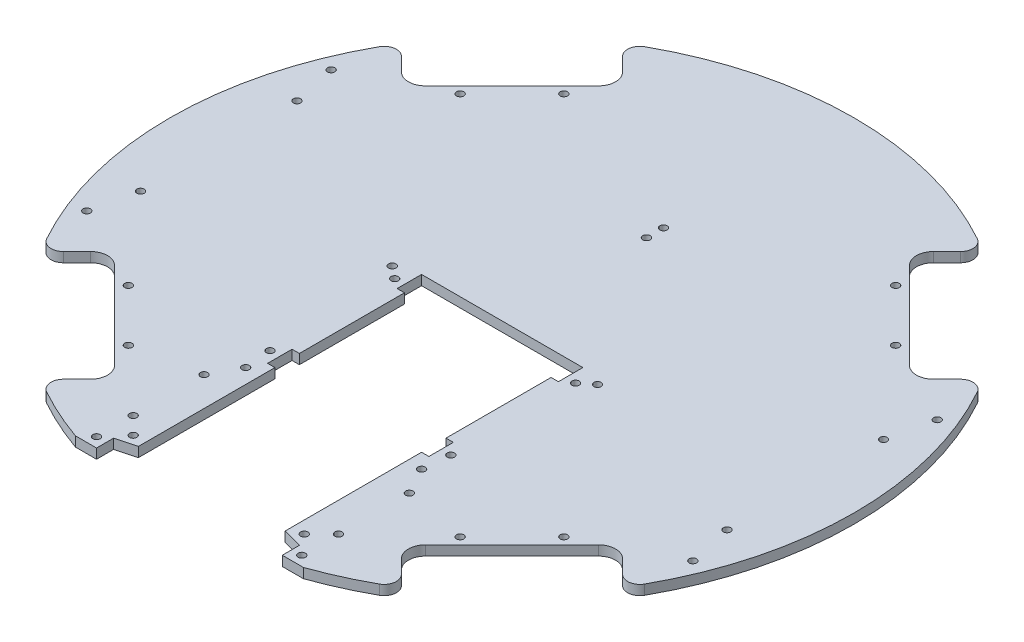
from build123d import *

# Parameters (mm, degrees)
SKETCH1_R                = 140
BOSS_EXTRUDE1_DEPTH      = 4
CUT_EXTRUDE4_REACH       = 200.03
CUT_EXTRUDE6_REACH       = 200.03
SKETCH9_R                = 1.5
FILLET1_R                = 5
CIRPATTERN1_COUNT        = 4
FILLET1_OF_CIRPATTERN1_R = 5
CUT_EXTRUDE1_REACH       = 200.03
FILLET3_R                = 1.5
CUT_EXTRUDE7_REACH       = 200.03
SKETCH10_R               = 1.5
CUT_EXTRUDE9_REACH       = 200.03
SKETCH13_R               = 1.5
CUT_EXTRUDE12_REACH      = 200.03
SKETCH16_R               = 1.5
CUT_EXTRUDE13_REACH      = 200.03
SKETCH17_R               = 1.5
CUT_EXTRUDE15_REACH      = 200.03
SKETCH19_R               = 1.5
CUT_EXTRUDE17_REACH      = 200.03
SKETCH21_R               = 1.5
CUT_EXTRUDE18_REACH      = 200.03
SKETCH22_R               = 1.5


with BuildPart() as part:
    # Sketch1 → Boss-Extrude1 (new body)
    with BuildSketch(Plane(origin=(0, 0, 0), x_dir=(1, 0, 0), z_dir=(0, 1, 0))):
        with Locations(Location((0, 0, 0), (0, 0, 270))):
            Circle(SKETCH1_R)
    extrude(amount=BOSS_EXTRUDE1_DEPTH)

    # Sketch7 → Cut-Extrude4 (cut, up to next)
    with BuildSketch(Plane(origin=(0, 4, 0), x_dir=(1, 0, 0), z_dir=(0, 1, 0)), mode=Mode.PRIVATE) as cut_extrude4_sk1:
        with BuildLine():
            Line((-99.030304705, -63.604254968), (-63.604254968, -99.030304705))
            ThreePointArc((-63.604254968, -99.030304705), (-61.568647097, -103.944696834), (-63.604254968, -108.859088964))
            Line((-63.604254968, -108.859088964), (-76.367532368, -121.622366364))
            Line((-76.367532368, -121.622366364), (-121.622366364, -76.367532368))
            Line((-121.622366364, -76.367532368), (-108.859088964, -63.604254968))
            ThreePointArc((-108.859088964, -63.604254968), (-103.944696834, -61.568647097), (-99.030304705, -63.604254968))
        make_face()
    cut_extrude4_tool1 = extrude(cut_extrude4_sk1.sketch, amount=-CUT_EXTRUDE4_REACH, mode=Mode.PRIVATE) & part.part
    cut_extrude4 = cut_extrude4_tool1.solids().sort_by_distance((-90.257735, 4, 90.257735))[0]
    add(cut_extrude4, mode=Mode.SUBTRACT)

    # Sketch9 → Cut-Extrude6 (cut, up to next)
    with BuildSketch(Plane(origin=(0, 4, 0), x_dir=(1, 0, 0), z_dir=(0, 1, 0)), mode=Mode.PRIVATE) as cut_extrude6_sk1:
        with Locations(Location((-89.09545443, -67.882250994, 0), (0, 0, 270))):
            Circle(SKETCH9_R)
    cut_extrude6_tool1 = extrude(cut_extrude6_sk1.sketch, amount=-CUT_EXTRUDE6_REACH, mode=Mode.PRIVATE) & part.part
    # Sketch9 → Cut-Extrude6 (cut, up to next)
    with BuildSketch(Plane(origin=(0, 4, 0), x_dir=(1, 0, 0), z_dir=(0, 1, 0)), mode=Mode.PRIVATE) as cut_extrude6_sk2:
        with Locations(Location((-67.882250994, -89.09545443, 0), (0, 0, 270))):
            Circle(SKETCH9_R)
    cut_extrude6_tool2 = extrude(cut_extrude6_sk2.sketch, amount=-CUT_EXTRUDE6_REACH, mode=Mode.PRIVATE) & part.part
    cut_extrude6_1 = cut_extrude6_tool1.solids().sort_by_distance((-89.095454, 4, 67.882251))[0]
    add(cut_extrude6_1, mode=Mode.SUBTRACT)
    cut_extrude6_2 = cut_extrude6_tool2.solids().sort_by_distance((-67.882251, 4, 89.095454))[0]
    add(cut_extrude6_2, mode=Mode.SUBTRACT)
    cut_extrude6 = cut_extrude6_1 + cut_extrude6_2  # Cut-Extrude6 as one shape, for the pattern or mirror that repeats it

    # Fillet1
    fillet1_edges = [part.edges().sort_by_distance(p)[0] for p in [
        (-119.001687423, 2, 73.746853427),
        (-73.746853427, 2, 119.001687423),
    ]]
    fillet(fillet1_edges, radius=FILLET1_R)

    # CirPattern1: Cut-Extrude4, Cut-Extrude6 ×4 about axis
    cirpattern1_axis = Axis((0, 0, 0), (0, 1, 0))
    add([cut_extrude4.rotate(cirpattern1_axis, i * 360 / CIRPATTERN1_COUNT) for i in range(1, CIRPATTERN1_COUNT)], mode=Mode.SUBTRACT)
    add([cut_extrude6.rotate(cirpattern1_axis, i * 360 / CIRPATTERN1_COUNT) for i in range(1, CIRPATTERN1_COUNT)], mode=Mode.SUBTRACT)

    # Fillet1 of CirPattern1
    fillet1_of_cirpattern1_edges = [part.edges().sort_by_distance(p)[0] for p in [
        (73.746853427, 2, 119.001687423),
        (119.001687423, 2, 73.746853427),
        (119.001687423, 2, -73.746853427),
        (73.746853427, 2, -119.001687423),
        (-73.746853427, 2, -119.001687423),
        (-119.001687423, 2, -73.746853427),
    ]]
    fillet(fillet1_of_cirpattern1_edges, radius=FILLET1_OF_CIRPATTERN1_R)

    # Sketch2 → Cut-Extrude1 (cut, up to next)
    with BuildSketch(Plane(origin=(0, 4, 0), x_dir=(1, 0, 0), z_dir=(0, 1, 0)), mode=Mode.PRIVATE) as cut_extrude1_sk1:
        Polygon((-46.647615159, -132), (-38, -132), (-38, -125), (-30, -122.856406461), (-30, -67), (-33, -67), (-33, -57), (-30, -57), (-30, -14), (-33, -14), (-33, -4), (33, -4), (33, -14), (30, -14), (30, -57), (33, -57), (33, -67), (30, -67), (30, -122.856406461), (38, -125), (38, -132), (46.647615159, -132), (46.647615159, -140), (-46.647615159, -140), align=None)
    cut_extrude1_tool1 = extrude(cut_extrude1_sk1.sketch, amount=-CUT_EXTRUDE1_REACH, mode=Mode.PRIVATE) & part.part
    add(cut_extrude1_tool1.solids().sort_by_distance((0, 4, 74.292867))[0], mode=Mode.SUBTRACT)

    # Fillet3
    fillet3_edges = [part.edges().sort_by_distance(p)[0] for p in [
        (66.382250994, 0, 89.09545443),
        (87.59545443, 0, 67.882250994),
        (89.09545443, 0, -66.382250994),
        (67.882250994, 0, -87.59545443),
        (-66.382250994, 0, -89.09545443),
        (-87.59545443, 0, -67.882250994),
        (-89.09545443, 0, 66.382250994),
        (-67.882250994, 0, 87.59545443),
    ]]
    fillet(fillet3_edges, radius=FILLET3_R)

    # Sketch10 → Cut-Extrude7 (cut, up to next)
    with BuildSketch(Plane(origin=(0, 4, 0), x_dir=(1, 0, 0), z_dir=(0, 1, 0)), mode=Mode.PRIVATE) as cut_extrude7_sk1:
        with Locations(Location((-37, -62, 0), (0, 0, 270))):
            Circle(SKETCH10_R)
    cut_extrude7_tool1 = extrude(cut_extrude7_sk1.sketch, amount=-CUT_EXTRUDE7_REACH, mode=Mode.PRIVATE) & part.part
    # Sketch10 → Cut-Extrude7 (cut, up to next)
    with BuildSketch(Plane(origin=(0, 4, 0), x_dir=(1, 0, 0), z_dir=(0, 1, 0)), mode=Mode.PRIVATE) as cut_extrude7_sk2:
        with Locations(Location((37, -62, 0), (0, 0, 270))):
            Circle(SKETCH10_R)
    cut_extrude7_tool2 = extrude(cut_extrude7_sk2.sketch, amount=-CUT_EXTRUDE7_REACH, mode=Mode.PRIVATE) & part.part
    # Sketch10 → Cut-Extrude7 (cut, up to next)
    with BuildSketch(Plane(origin=(0, 4, 0), x_dir=(1, 0, 0), z_dir=(0, 1, 0)), mode=Mode.PRIVATE) as cut_extrude7_sk3:
        with Locations(Location((-37, -11, 0), (0, 0, 270))):
            Circle(SKETCH10_R)
    cut_extrude7_tool3 = extrude(cut_extrude7_sk3.sketch, amount=-CUT_EXTRUDE7_REACH, mode=Mode.PRIVATE) & part.part
    # Sketch10 → Cut-Extrude7 (cut, up to next)
    with BuildSketch(Plane(origin=(0, 4, 0), x_dir=(1, 0, 0), z_dir=(0, 1, 0)), mode=Mode.PRIVATE) as cut_extrude7_sk4:
        with Locations(Location((37, -11, 0), (0, 0, 270))):
            Circle(SKETCH10_R)
    cut_extrude7_tool4 = extrude(cut_extrude7_sk4.sketch, amount=-CUT_EXTRUDE7_REACH, mode=Mode.PRIVATE) & part.part
    # Sketch10 → Cut-Extrude7 (cut, up to next)
    with BuildSketch(Plane(origin=(0, 4, 0), x_dir=(1, 0, 0), z_dir=(0, 1, 0)), mode=Mode.PRIVATE) as cut_extrude7_sk5:
        with Locations(Location((-42, -7, 0), (0, 0, 270))):
            Circle(SKETCH10_R)
    cut_extrude7_tool5 = extrude(cut_extrude7_sk5.sketch, amount=-CUT_EXTRUDE7_REACH, mode=Mode.PRIVATE) & part.part
    # Sketch10 → Cut-Extrude7 (cut, up to next)
    with BuildSketch(Plane(origin=(0, 4, 0), x_dir=(1, 0, 0), z_dir=(0, 1, 0)), mode=Mode.PRIVATE) as cut_extrude7_sk6:
        with Locations(Location((42, -7, 0), (0, 0, 270))):
            Circle(SKETCH10_R)
    cut_extrude7_tool6 = extrude(cut_extrude7_sk6.sketch, amount=-CUT_EXTRUDE7_REACH, mode=Mode.PRIVATE) & part.part
    add(cut_extrude7_tool1.solids().sort_by_distance((-37, 4, 62))[0], mode=Mode.SUBTRACT)
    add(cut_extrude7_tool2.solids().sort_by_distance((37, 4, 62))[0], mode=Mode.SUBTRACT)
    add(cut_extrude7_tool3.solids().sort_by_distance((-37, 4, 11))[0], mode=Mode.SUBTRACT)
    add(cut_extrude7_tool4.solids().sort_by_distance((37, 4, 11))[0], mode=Mode.SUBTRACT)
    add(cut_extrude7_tool5.solids().sort_by_distance((-42, 4, 7))[0], mode=Mode.SUBTRACT)
    add(cut_extrude7_tool6.solids().sort_by_distance((42, 4, 7))[0], mode=Mode.SUBTRACT)

    # Sketch13 → Cut-Extrude9 (cut, up to next)
    with BuildSketch(Plane(origin=(0, 4, 0), x_dir=(1, 0, 0), z_dir=(0, 1, 0)), mode=Mode.PRIVATE) as cut_extrude9_sk1:
        with Locations(Location((-42, -84, 0), (0, 0, 270))):
            Circle(SKETCH13_R)
    cut_extrude9_tool1 = extrude(cut_extrude9_sk1.sketch, amount=-CUT_EXTRUDE9_REACH, mode=Mode.PRIVATE) & part.part
    # Sketch13 → Cut-Extrude9 (cut, up to next)
    with BuildSketch(Plane(origin=(0, 4, 0), x_dir=(1, 0, 0), z_dir=(0, 1, 0)), mode=Mode.PRIVATE) as cut_extrude9_sk2:
        with Locations(Location((-42, -113, 0), (0, 0, 270))):
            Circle(SKETCH13_R)
    cut_extrude9_tool2 = extrude(cut_extrude9_sk2.sketch, amount=-CUT_EXTRUDE9_REACH, mode=Mode.PRIVATE) & part.part
    # Sketch13 → Cut-Extrude9 (cut, up to next)
    with BuildSketch(Plane(origin=(0, 4, 0), x_dir=(1, 0, 0), z_dir=(0, 1, 0)), mode=Mode.PRIVATE) as cut_extrude9_sk3:
        with Locations(Location((42, -113, 0), (0, 0, 270))):
            Circle(SKETCH13_R)
    cut_extrude9_tool3 = extrude(cut_extrude9_sk3.sketch, amount=-CUT_EXTRUDE9_REACH, mode=Mode.PRIVATE) & part.part
    # Sketch13 → Cut-Extrude9 (cut, up to next)
    with BuildSketch(Plane(origin=(0, 4, 0), x_dir=(1, 0, 0), z_dir=(0, 1, 0)), mode=Mode.PRIVATE) as cut_extrude9_sk4:
        with Locations(Location((42, -84, 0), (0, 0, 270))):
            Circle(SKETCH13_R)
    cut_extrude9_tool4 = extrude(cut_extrude9_sk4.sketch, amount=-CUT_EXTRUDE9_REACH, mode=Mode.PRIVATE) & part.part
    add(cut_extrude9_tool1.solids().sort_by_distance((-42, 4, 84))[0], mode=Mode.SUBTRACT)
    add(cut_extrude9_tool2.solids().sort_by_distance((-42, 4, 113))[0], mode=Mode.SUBTRACT)
    add(cut_extrude9_tool3.solids().sort_by_distance((42, 4, 113))[0], mode=Mode.SUBTRACT)
    add(cut_extrude9_tool4.solids().sort_by_distance((42, 4, 84))[0], mode=Mode.SUBTRACT)

    # Sketch16 → Cut-Extrude12 (cut, up to next)
    with BuildSketch(Plane(origin=(0, 4, 0), x_dir=(1, 0, 0), z_dir=(0, 1, 0)), mode=Mode.PRIVATE) as cut_extrude12_sk1:
        with Locations(Location((0, 62, 0), (0, 0, 270))):
            Circle(SKETCH16_R)
    cut_extrude12_tool1 = extrude(cut_extrude12_sk1.sketch, amount=-CUT_EXTRUDE12_REACH, mode=Mode.PRIVATE) & part.part
    # Sketch16 → Cut-Extrude12 (cut, up to next)
    with BuildSketch(Plane(origin=(0, 4, 0), x_dir=(1, 0, 0), z_dir=(0, 1, 0)), mode=Mode.PRIVATE) as cut_extrude12_sk2:
        with Locations(Location((0, 55, 0), (0, 0, 270))):
            Circle(SKETCH16_R)
    cut_extrude12_tool2 = extrude(cut_extrude12_sk2.sketch, amount=-CUT_EXTRUDE12_REACH, mode=Mode.PRIVATE) & part.part
    add(cut_extrude12_tool1.solids().sort_by_distance((0, 4, -62))[0], mode=Mode.SUBTRACT)
    add(cut_extrude12_tool2.solids().sort_by_distance((0, 4, -55))[0], mode=Mode.SUBTRACT)

    # Sketch17 → Cut-Extrude13 (cut, up to next)
    with BuildSketch(Plane(origin=(0, 4, 0), x_dir=(1, 0, 0), z_dir=(0, 1, 0)), mode=Mode.PRIVATE) as cut_extrude13_sk1:
        with Locations(Location((-124, 50, 0), (0, 0, 270))):
            Circle(SKETCH17_R)
    cut_extrude13_tool1 = extrude(cut_extrude13_sk1.sketch, amount=-CUT_EXTRUDE13_REACH, mode=Mode.PRIVATE) & part.part
    # Sketch17 → Cut-Extrude13 (cut, up to next)
    with BuildSketch(Plane(origin=(0, 4, 0), x_dir=(1, 0, 0), z_dir=(0, 1, 0)), mode=Mode.PRIVATE) as cut_extrude13_sk2:
        with Locations(Location((-124, -50, 0), (0, 0, 270))):
            Circle(SKETCH17_R)
    cut_extrude13_tool2 = extrude(cut_extrude13_sk2.sketch, amount=-CUT_EXTRUDE13_REACH, mode=Mode.PRIVATE) & part.part
    # Sketch17 → Cut-Extrude13 (cut, up to next)
    with BuildSketch(Plane(origin=(0, 4, 0), x_dir=(1, 0, 0), z_dir=(0, 1, 0)), mode=Mode.PRIVATE) as cut_extrude13_sk3:
        with Locations(Location((124, 50, 0), (0, 0, 270))):
            Circle(SKETCH17_R)
    cut_extrude13_tool3 = extrude(cut_extrude13_sk3.sketch, amount=-CUT_EXTRUDE13_REACH, mode=Mode.PRIVATE) & part.part
    # Sketch17 → Cut-Extrude13 (cut, up to next)
    with BuildSketch(Plane(origin=(0, 4, 0), x_dir=(1, 0, 0), z_dir=(0, 1, 0)), mode=Mode.PRIVATE) as cut_extrude13_sk4:
        with Locations(Location((124, -50, 0), (0, 0, 270))):
            Circle(SKETCH17_R)
    cut_extrude13_tool4 = extrude(cut_extrude13_sk4.sketch, amount=-CUT_EXTRUDE13_REACH, mode=Mode.PRIVATE) & part.part
    add(cut_extrude13_tool1.solids().sort_by_distance((-124, 4, -50))[0], mode=Mode.SUBTRACT)
    add(cut_extrude13_tool2.solids().sort_by_distance((-124, 4, 50))[0], mode=Mode.SUBTRACT)
    add(cut_extrude13_tool3.solids().sort_by_distance((124, 4, -50))[0], mode=Mode.SUBTRACT)
    add(cut_extrude13_tool4.solids().sort_by_distance((124, 4, 50))[0], mode=Mode.SUBTRACT)

    # Sketch19 → Cut-Extrude15 (cut, up to next)
    with BuildSketch(Plane(origin=(0, 4, 0), x_dir=(1, 0, 0), z_dir=(0, 1, 0)), mode=Mode.PRIVATE) as cut_extrude15_sk1:
        with Locations(Location((-42, -128, 0), (0, 0, 270))):
            Circle(SKETCH19_R)
    cut_extrude15_tool1 = extrude(cut_extrude15_sk1.sketch, amount=-CUT_EXTRUDE15_REACH, mode=Mode.PRIVATE) & part.part
    # Sketch19 → Cut-Extrude15 (cut, up to next)
    with BuildSketch(Plane(origin=(0, 4, 0), x_dir=(1, 0, 0), z_dir=(0, 1, 0)), mode=Mode.PRIVATE) as cut_extrude15_sk2:
        with Locations(Location((42, -128, 0), (0, 0, 270))):
            Circle(SKETCH19_R)
    cut_extrude15_tool2 = extrude(cut_extrude15_sk2.sketch, amount=-CUT_EXTRUDE15_REACH, mode=Mode.PRIVATE) & part.part
    add(cut_extrude15_tool1.solids().sort_by_distance((-42, 4, 128))[0], mode=Mode.SUBTRACT)
    add(cut_extrude15_tool2.solids().sort_by_distance((42, 4, 128))[0], mode=Mode.SUBTRACT)

    # Sketch21 → Cut-Extrude17 (cut, up to next)
    with BuildSketch(Plane(origin=(0, 4, 0), x_dir=(1, 0, 0), z_dir=(0, 1, 0)), mode=Mode.PRIVATE) as cut_extrude17_sk1:
        with Locations(Location((-35, -120, 0), (0, 0, 270))):
            Circle(SKETCH21_R)
    cut_extrude17_tool1 = extrude(cut_extrude17_sk1.sketch, amount=-CUT_EXTRUDE17_REACH, mode=Mode.PRIVATE) & part.part
    # Sketch21 → Cut-Extrude17 (cut, up to next)
    with BuildSketch(Plane(origin=(0, 4, 0), x_dir=(1, 0, 0), z_dir=(0, 1, 0)), mode=Mode.PRIVATE) as cut_extrude17_sk2:
        with Locations(Location((-36, -73, 0), (0, 0, 270))):
            Circle(SKETCH21_R)
    cut_extrude17_tool2 = extrude(cut_extrude17_sk2.sketch, amount=-CUT_EXTRUDE17_REACH, mode=Mode.PRIVATE) & part.part
    # Sketch21 → Cut-Extrude17 (cut, up to next)
    with BuildSketch(Plane(origin=(0, 4, 0), x_dir=(1, 0, 0), z_dir=(0, 1, 0)), mode=Mode.PRIVATE) as cut_extrude17_sk3:
        with Locations(Location((35, -120, 0), (0, 0, 270))):
            Circle(SKETCH21_R)
    cut_extrude17_tool3 = extrude(cut_extrude17_sk3.sketch, amount=-CUT_EXTRUDE17_REACH, mode=Mode.PRIVATE) & part.part
    # Sketch21 → Cut-Extrude17 (cut, up to next)
    with BuildSketch(Plane(origin=(0, 4, 0), x_dir=(1, 0, 0), z_dir=(0, 1, 0)), mode=Mode.PRIVATE) as cut_extrude17_sk4:
        with Locations(Location((36, -73, 0), (0, 0, 270))):
            Circle(SKETCH21_R)
    cut_extrude17_tool4 = extrude(cut_extrude17_sk4.sketch, amount=-CUT_EXTRUDE17_REACH, mode=Mode.PRIVATE) & part.part
    add(cut_extrude17_tool1.solids().sort_by_distance((-35, 4, 120))[0], mode=Mode.SUBTRACT)
    add(cut_extrude17_tool2.solids().sort_by_distance((-36, 4, 73))[0], mode=Mode.SUBTRACT)
    add(cut_extrude17_tool3.solids().sort_by_distance((35, 4, 120))[0], mode=Mode.SUBTRACT)
    add(cut_extrude17_tool4.solids().sort_by_distance((36, 4, 73))[0], mode=Mode.SUBTRACT)

    # Sketch22 → Cut-Extrude18 (cut, up to next)
    with BuildSketch(Plane(origin=(0, 4, 0), x_dir=(1, 0, 0), z_dir=(0, 1, 0)), mode=Mode.PRIVATE) as cut_extrude18_sk1:
        with Locations(Location((120, 32, 0), (0, 0, 270))):
            Circle(SKETCH22_R)
    cut_extrude18_tool1 = extrude(cut_extrude18_sk1.sketch, amount=-CUT_EXTRUDE18_REACH, mode=Mode.PRIVATE) & part.part
    # Sketch22 → Cut-Extrude18 (cut, up to next)
    with BuildSketch(Plane(origin=(0, 4, 0), x_dir=(1, 0, 0), z_dir=(0, 1, 0)), mode=Mode.PRIVATE) as cut_extrude18_sk2:
        with Locations(Location((120, -32, 0), (0, 0, 270))):
            Circle(SKETCH22_R)
    cut_extrude18_tool2 = extrude(cut_extrude18_sk2.sketch, amount=-CUT_EXTRUDE18_REACH, mode=Mode.PRIVATE) & part.part
    # Sketch22 → Cut-Extrude18 (cut, up to next)
    with BuildSketch(Plane(origin=(0, 4, 0), x_dir=(1, 0, 0), z_dir=(0, 1, 0)), mode=Mode.PRIVATE) as cut_extrude18_sk3:
        with Locations(Location((-120, 32, 0), (0, 0, 270))):
            Circle(SKETCH22_R)
    cut_extrude18_tool3 = extrude(cut_extrude18_sk3.sketch, amount=-CUT_EXTRUDE18_REACH, mode=Mode.PRIVATE) & part.part
    # Sketch22 → Cut-Extrude18 (cut, up to next)
    with BuildSketch(Plane(origin=(0, 4, 0), x_dir=(1, 0, 0), z_dir=(0, 1, 0)), mode=Mode.PRIVATE) as cut_extrude18_sk4:
        with Locations(Location((-120, -32, 0), (0, 0, 270))):
            Circle(SKETCH22_R)
    cut_extrude18_tool4 = extrude(cut_extrude18_sk4.sketch, amount=-CUT_EXTRUDE18_REACH, mode=Mode.PRIVATE) & part.part
    add(cut_extrude18_tool1.solids().sort_by_distance((120, 4, -32))[0], mode=Mode.SUBTRACT)
    add(cut_extrude18_tool2.solids().sort_by_distance((120, 4, 32))[0], mode=Mode.SUBTRACT)
    add(cut_extrude18_tool3.solids().sort_by_distance((-120, 4, -32))[0], mode=Mode.SUBTRACT)
    add(cut_extrude18_tool4.solids().sort_by_distance((-120, 4, 32))[0], mode=Mode.SUBTRACT)


solid = part.part
